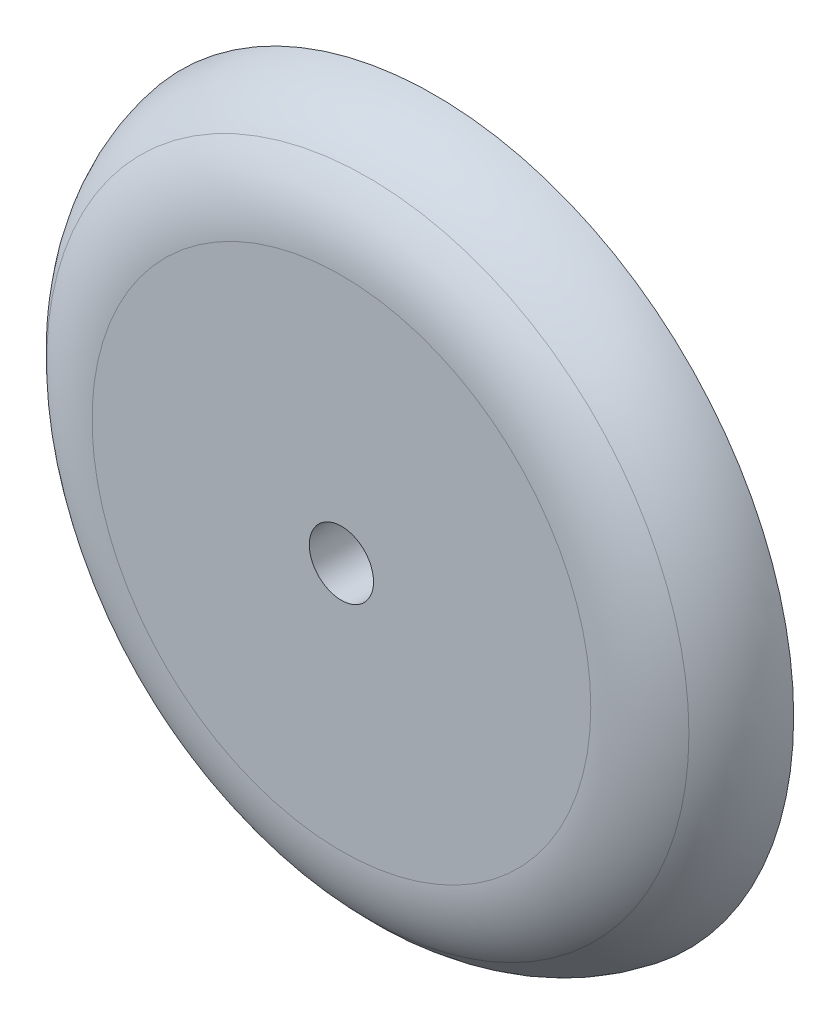
from build123d import *

# Parameters (mm, degrees)
SKETCH1_W = 12
SKETCH1_H = 53.690960396


with BuildPart() as part:
    # Sketch1 → Revolve1 (revolve)
    with BuildSketch(Plane(origin=(0, 0, 0), x_dir=(0, 0, -1), z_dir=(1, 0, 0)), mode=Mode.PRIVATE) as revolve1_sk:
        with BuildLine():
            Line((0, 8.5), (-24.7, 8.5))
            Line((-24.7, 8.5), (-24.7, 66))
            ThreePointArc((-24.7, 66), (-22.903230037, 76.118602871), (-17.732611951, 85))
            ThreePointArc((-17.732611951, 85), (-9.761601016, 91.587591953), (0, 95))
            Line((0, 95), (0, 8.5))
        make_face()
        with Locations((-9.145311229, 53.422633767)):
            Rectangle(SKETCH1_W, SKETCH1_H, mode=Mode.SUBTRACT)
    revolve(revolve1_sk.sketch.rotate(Axis((0, 0, 15.387931034), (0, 0, -1)), 90), axis=Axis((0, 0, 15.387931034), (0, 0, -1)))


solid = part.part
